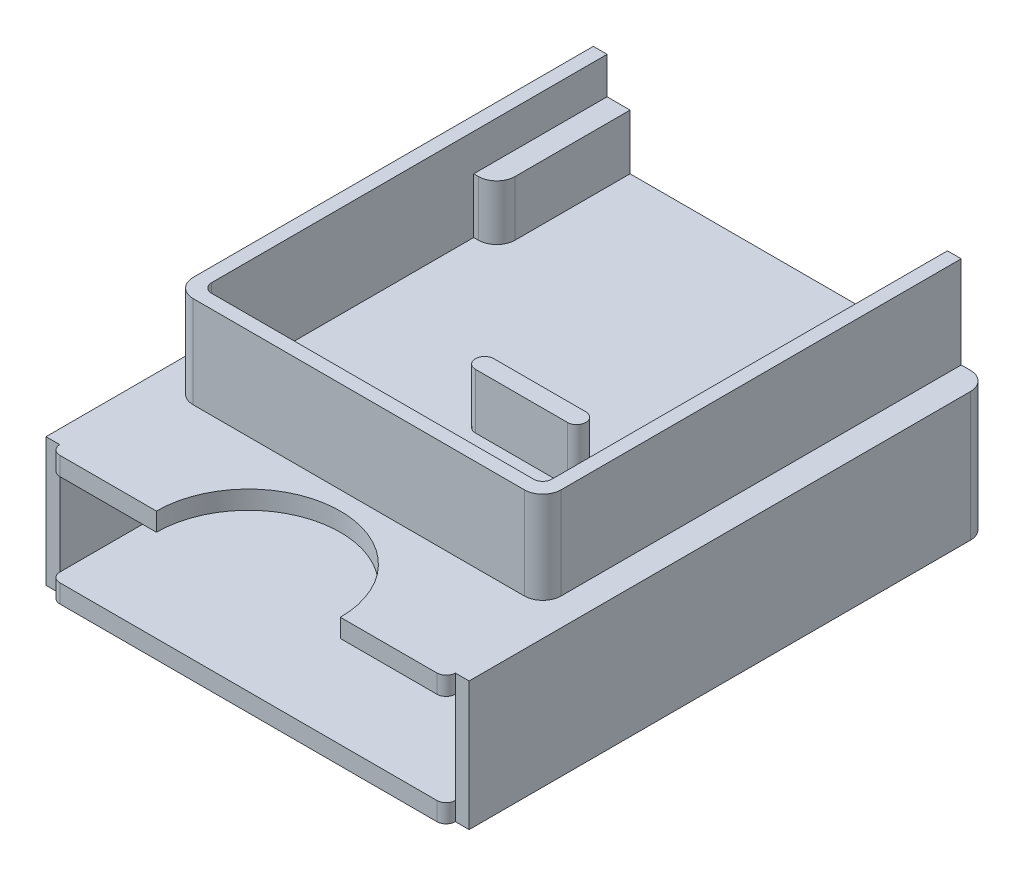
from build123d import *

# Parameters (mm, degrees)
BOSS_EXTRUDE23_DEPTH = 1
BOSS_EXTRUDE27_DEPTH = 6
BOSS_EXTRUDE28_START = 6
BOSS_EXTRUDE28_DEPTH = 1
CUT_EXTRUDE9_DEPTH   = 1
SKETCH15_W           = 10
SKETCH15_H           = 2
CUT_EXTRUDE11_DEPTH  = 10
BOSS_EXTRUDE30_DEPTH = 5
BOSS_EXTRUDE31_DEPTH = 3


with BuildPart() as part:
    # Sketch10 → Boss-Extrude23 (new body)
    with BuildSketch(Plane(origin=(0, 0, 0), x_dir=(1, 0, 0), z_dir=(0, 1, 0))):
        with BuildLine():
            Line((-11.5, -13.5), (-10.75, -13.5))
            ThreePointArc((-10.75, -13.5), (-10.603553391, -13.853553391), (-10.25, -14))
            Line((-10.25, -14), (10.25, -14))
            ThreePointArc((10.25, -14), (10.603553391, -13.853553391), (10.75, -13.5))
            Line((10.75, -13.5), (11.5, -13.5))
            Line((11.5, -13.5), (11.5, 13.75))
            ThreePointArc((11.5, 13.75), (11.207106781, 14.457106781), (10.5, 14.75))
            Line((10.5, 14.75), (-10.5, 14.75))
            ThreePointArc((-10.5, 14.75), (-11.207106781, 14.457106781), (-11.5, 13.75))
            Line((-11.5, 13.75), (-11.5, -13.5))
        make_face()
    extrude(amount=BOSS_EXTRUDE23_DEPTH)

    # Sketch10<6> → Boss-Extrude27 (add)
    with BuildSketch(Plane(origin=(0, 0, 0), x_dir=(1, 0, 0), z_dir=(0, 1, 0))):
        with BuildLine():
            Line((-11.5, -13.5), (-10.75, -13.5))
            Line((-10.75, -13.5), (-10.75, 13.5))
            ThreePointArc((-10.75, 13.5), (-10.603553391, 13.853553391), (-10.25, 14))
            Line((-10.25, 14), (10.25, 14))
            ThreePointArc((10.25, 14), (10.603553391, 13.853553391), (10.75, 13.5))
            Line((10.75, 13.5), (10.75, -13.5))
            Line((10.75, -13.5), (11.5, -13.5))
            Line((11.5, -13.5), (11.5, 13.75))
            ThreePointArc((11.5, 13.75), (11.207106781, 14.457106781), (10.5, 14.75))
            Line((10.5, 14.75), (4.75, 14.75))
            Line((4.75, 14.75), (-4.75, 14.75))
            Line((-4.75, 14.75), (-10.5, 14.75))
            ThreePointArc((-10.5, 14.75), (-11.207106781, 14.457106781), (-11.5, 13.75))
            Line((-11.5, 13.75), (-11.5, -13.5))
        make_face()
    extrude(amount=BOSS_EXTRUDE27_DEPTH)

    # Sketch10<7> → Boss-Extrude28 (add)
    with BuildSketch(Plane(origin=(0, 0, 0), x_dir=(1, 0, 0), z_dir=(0, 1, 0)).offset(BOSS_EXTRUDE28_START)):
        with BuildLine():
            Line((-11.5, -13.5), (-10.75, -13.5))
            ThreePointArc((-10.75, -13.5), (-10.603553391, -13.853553391), (-10.25, -14))
            Line((-10.25, -14), (10.25, -14))
            ThreePointArc((10.25, -14), (10.603553391, -13.853553391), (10.75, -13.5))
            Line((10.75, -13.5), (11.5, -13.5))
            Line((11.5, -13.5), (11.5, 13.75))
            ThreePointArc((11.5, 13.75), (11.207106781, 14.457106781), (10.5, 14.75))
            Line((10.5, 14.75), (-10.5, 14.75))
            ThreePointArc((-10.5, 14.75), (-11.207106781, 14.457106781), (-11.5, 13.75))
            Line((-11.5, 13.75), (-11.5, -13.5))
        make_face()
    extrude(amount=BOSS_EXTRUDE28_DEPTH)

    # Sketch13 → Cut-Extrude9 (cut)
    with BuildSketch(Plane(origin=(0, 7, 0), x_dir=(1, 0, 0), z_dir=(0, 1, 0))):
        with BuildLine():
            Line((-5, -14), (5, -14))
            ThreePointArc((5, -14), (0, -9), (-5, -14))
        make_face()
    extrude(amount=-CUT_EXTRUDE9_DEPTH, mode=Mode.SUBTRACT)

    # Sketch15 → Cut-Extrude11 (cut)
    with BuildSketch(Plane(origin=(0, 0, -14.75), x_dir=(-1, 0, 0), z_dir=(0, 0, -1))):
        with Locations((0, 2)):
            Rectangle(SKETCH15_W, SKETCH15_H)
    extrude(amount=-CUT_EXTRUDE11_DEPTH, mode=Mode.SUBTRACT)

    # Sketch17 → Boss-Extrude30 (add)
    with BuildSketch(Plane(origin=(0, 7, 0), x_dir=(1, 0, 0), z_dir=(0, 1, 0))):
        with BuildLine():
            Line((-9.25, -6.75), (-9.25, 14.75))
            Line((-9.25, 14.75), (-10, 14.75))
            Line((-10, 14.75), (-10, -7))
            ThreePointArc((-10, -7), (-9.707106781, -7.707106781), (-9, -8))
            Line((-9, -8), (9, -8))
            ThreePointArc((9, -8), (9.707106781, -7.707106781), (10, -7))
            Line((10, -7), (10, 14.75))
            Line((10, 14.75), (9.25, 14.75))
            Line((9.25, 14.75), (9.25, -6.75))
            ThreePointArc((9.25, -6.75), (9.103553391, -7.103553391), (8.75, -7.25))
            Line((8.75, -7.25), (-8.75, -7.25))
            ThreePointArc((-8.75, -7.25), (-9.103553391, -7.103553391), (-9.25, -6.75))
        make_face()
    extrude(amount=BOSS_EXTRUDE30_DEPTH)

    # Sketch18 → Boss-Extrude31 (add)
    with BuildSketch(Plane(origin=(0, 7, 0), x_dir=(1, 0, 0), z_dir=(0, 1, 0))):
        with BuildLine():
            ThreePointArc((8, 8.5), (8.292893219, 7.792893219), (9, 7.5))
            Line((9, 7.5), (9.25, 7.5))
            Line((9.25, 7.5), (9.25, 14.75))
            Line((9.25, 14.75), (8, 14.75))
            Line((8, 14.75), (8, 8.5))
        make_face()
        with BuildLine():
            Line((-8, 8.5), (-8, 14.75))
            Line((-8, 14.75), (-9.25, 14.75))
            Line((-9.25, 14.75), (-9.25, 7.5))
            Line((-9.25, 7.5), (-9, 7.5))
            ThreePointArc((-9, 7.5), (-8.292893219, 7.792893219), (-8, 8.5))
        make_face()
        with BuildLine():
            Line((0, -1.656788855), (5, -1.656788855))
            ThreePointArc((5, -1.656788855), (5.5, -1.156788855), (5, -0.656788855))
            Line((5, -0.656788855), (0, -0.656788855))
            ThreePointArc((0, -0.656788855), (-0.5, -1.156788855), (0, -1.656788855))
        make_face()
    extrude(amount=BOSS_EXTRUDE31_DEPTH)


solid = part.part
